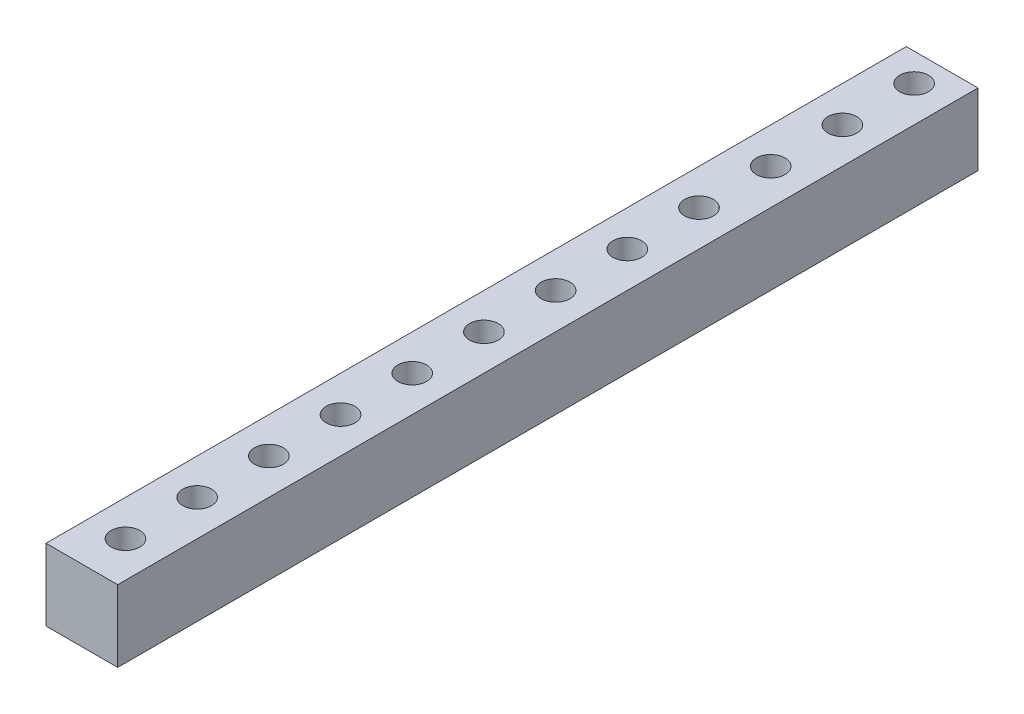
from build123d import *

# Parameters (mm, degrees)
SKETCH1_W             = 30.48
SKETCH1_H             = 2.54
BOSS_EXTRUDE1_DEPTH   = 2.54
F_1_0MM_DOWEL_HOLE2_D = 1.02
LPATTERN2_COUNT       = 12
LPATTERN2_PITCH       = 2.54


with BuildPart() as part:
    # Sketch1 → Boss-Extrude1 (new body)
    with BuildSketch(Plane(origin=(0, 0, 0), x_dir=(0, 0, -1), z_dir=(1, 0, 0))):
        Rectangle(SKETCH1_W, SKETCH1_H)
    extrude(amount=BOSS_EXTRUDE1_DEPTH)

    # Ø1.0mm Dowel Hole2 (through all)
    with Locations(Plane(origin=(0, 1.27, 0), x_dir=(1, 0, 0), z_dir=(0, 1, 0))):
        with Locations((1.27, -13.695105369)):
            f_1_0mm_dowel_hole2 = Hole(F_1_0MM_DOWEL_HOLE2_D / 2)

    # LPattern2: Ø1.0mm Dowel Hole2 ×12
    with Locations(*[(0, 0, -i * LPATTERN2_PITCH) for i in range(1, LPATTERN2_COUNT)]):
        add(f_1_0mm_dowel_hole2, mode=Mode.SUBTRACT)


solid = part.part
